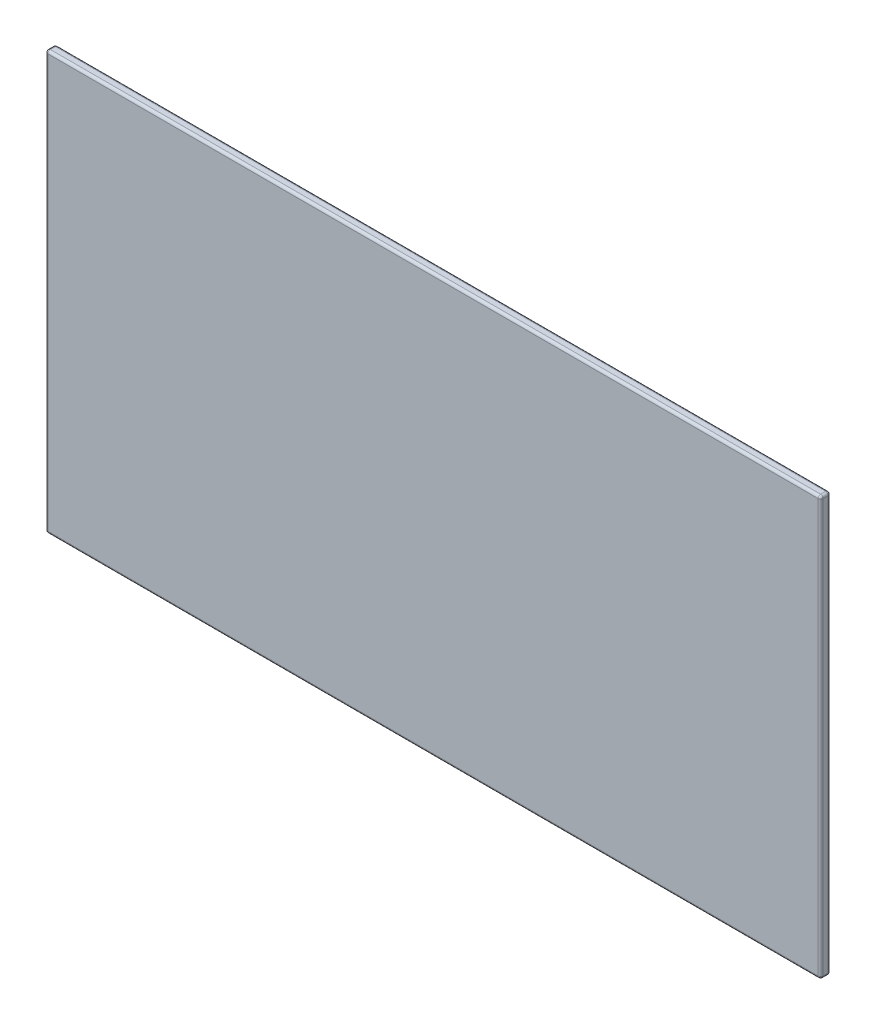
from build123d import *

# Parameters (mm, degrees)
SKETCH1_W           = 154.7
SKETCH1_H           = 83.5
BOSS_EXTRUDE1_DEPTH = 2
FILLET1_R           = 0.5


with BuildPart() as part:
    # Sketch1 → Boss-Extrude1 (new body)
    with BuildSketch(Plane.XY):
        Rectangle(SKETCH1_W, SKETCH1_H)
    extrude(amount=BOSS_EXTRUDE1_DEPTH)

    # Fillet1
    fillet1_edges = [part.edges().sort_by_distance(p)[0] for p in [
        (-77.35, 0, 2),
        (0, -41.75, 2),
        (77.35, 0, 2),
        (0, -41.75, 0),
        (-77.35, 0, 0),
        (0, 41.75, 0),
        (77.35, 0, 0),
        (77.35, -41.75, 1),
        (-77.35, -41.75, 1),
        (-77.35, 41.75, 1),
        (77.35, 41.75, 1),
        (0, 41.75, 2),
    ]]
    fillet(fillet1_edges, radius=FILLET1_R)


solid = part.part
